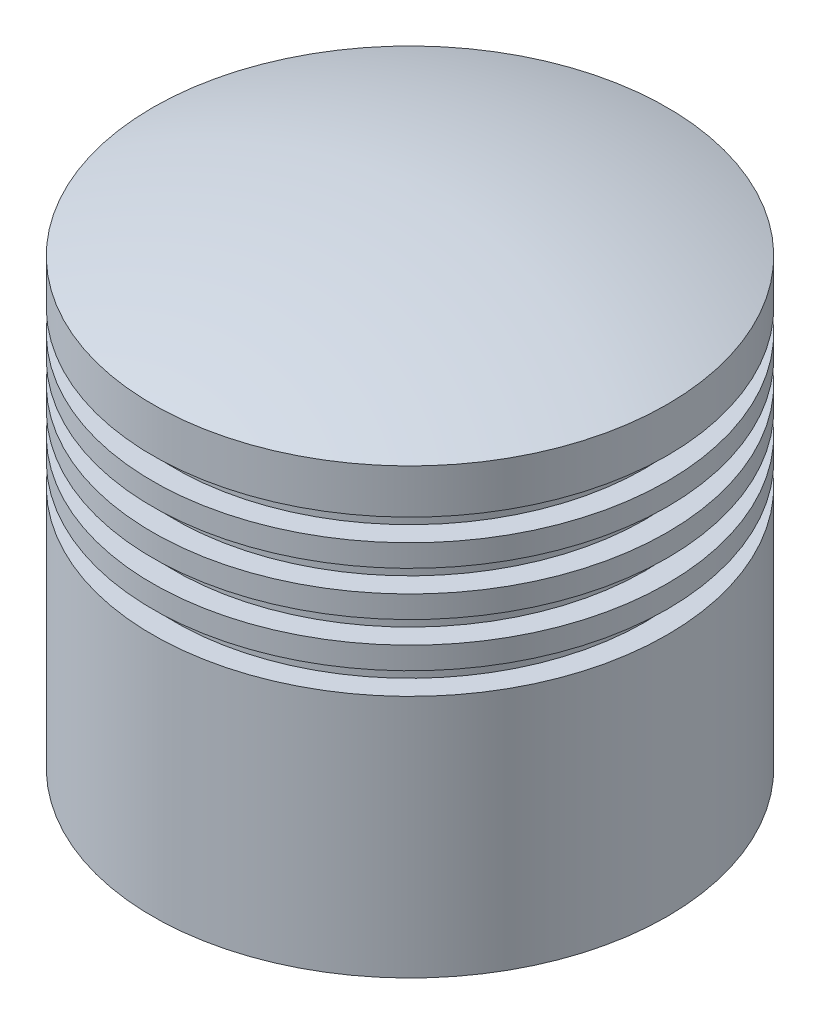
from build123d import *


with BuildPart() as part:
    # Sketch1 → Revolve1 (revolve)
    with BuildSketch(Plane.XY, mode=Mode.PRIVATE) as revolve1_sk:
        with BuildLine():
            Line((50, 0), (58, 0))
            Line((58, 0), (58, 55))
            Line((58, 55), (53, 55))
            Line((53, 55), (53, 60))
            Line((53, 60), (58, 60))
            Line((58, 60), (58, 65))
            Line((58, 65), (53, 65))
            Line((53, 65), (53, 70))
            Line((53, 70), (58, 70))
            Line((58, 70), (58, 75))
            Line((58, 75), (53, 75))
            Line((53, 75), (53, 80))
            Line((53, 80), (58, 80))
            Line((58, 80), (58, 85))
            Line((58, 85), (53, 85))
            Line((53, 85), (53, 90))
            Line((53, 90), (58, 90))
            Line((58, 90), (58, 100))
            ThreePointArc((58, 100), (29.445044376, 107.630676018), (0, 110.200125156))
            Line((0, 110.200125156), (0, 103.200125156))
            ThreePointArc((0, 103.200125156), (21.692969078, 101.750164131), (43, 97.426077213))
            Line((43, 97.426077213), (43, 30))
            Line((43, 30), (50, 30))
            Line((50, 30), (50, 0))
        make_face()
    revolve(revolve1_sk.sketch.rotate(Axis((0, 0, 0), (0, -1, 0)), 180), axis=Axis((0, 0, 0), (0, -1, 0)))


solid = part.part
